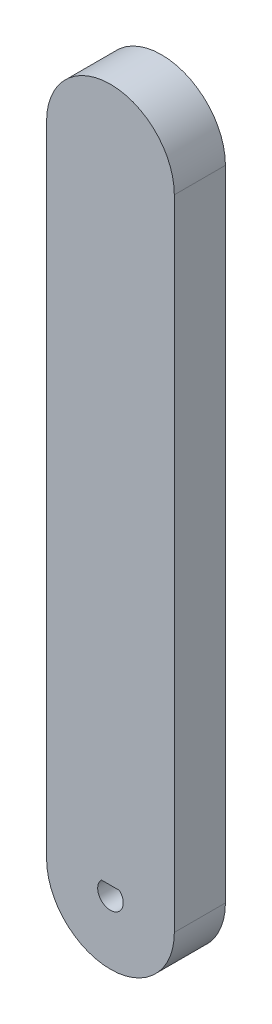
from build123d import *

# Parameters (mm, degrees)
SALIENTE_EXTRUIR1_DEPTH = 8


with BuildPart() as part:
    # Croquis3 → Saliente-Extruir1 (new body)
    with BuildSketch(Plane.XY):
        with BuildLine():
            Line((10, 100), (10, 0))
            ThreePointArc((10, 0), (0, -10), (-10, 0))
            Line((-10, 0), (-10, 100))
            ThreePointArc((-10, 100), (0, 110), (10, 100))
        make_face()
        with BuildLine():
            ThreePointArc((-1.428285686, 1.4), (0, -2), (1.428285686, 1.4))
            Line((1.428285686, 1.4), (-1.428285686, 1.4))
        make_face(mode=Mode.SUBTRACT)
    extrude(amount=SALIENTE_EXTRUIR1_DEPTH)


solid = part.part
